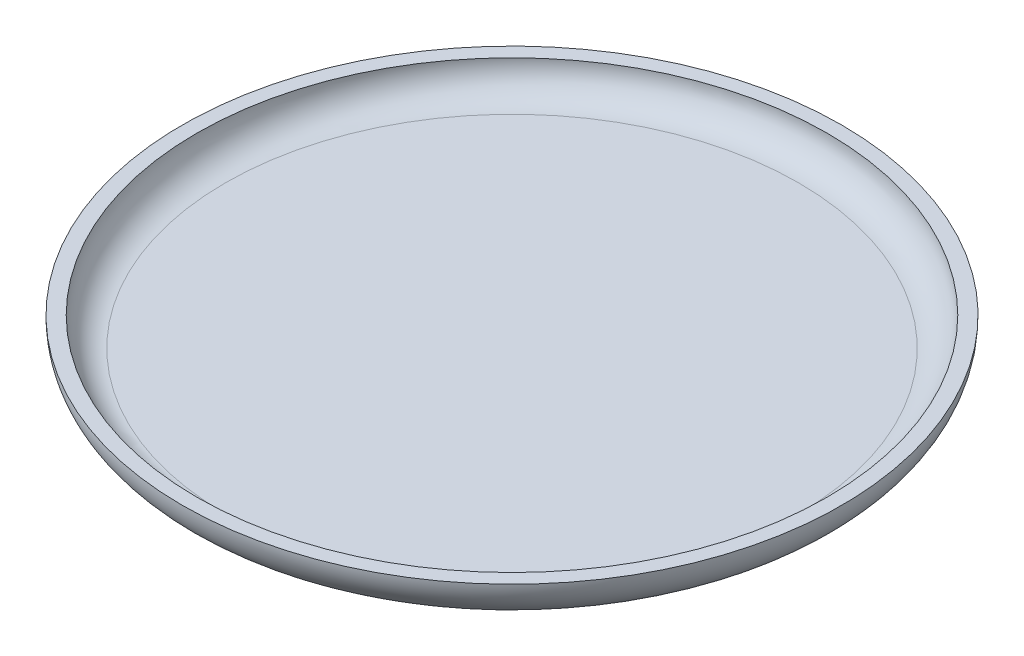
from build123d import *

# Parameters (mm, degrees)
SKETCH1_W          = 127
SKETCH1_H          = 6.35
SKETCH2_R          = 6.35
CUT_EXTRUDE1_DEPTH = 4.826


with BuildPart() as part:
    # Sketch1 → Revolve1 (revolve)
    with BuildSketch(Plane.XY, mode=Mode.PRIVATE) as revolve1_sk:
        with BuildLine():
            Line((127, 0), (127, 6.35))
            ThreePointArc((127, 6.35), (135.980256121, 10.069743879), (139.7, 19.05))
            Line((139.7, 19.05), (146.05, 19.05))
            ThreePointArc((146.05, 19.05), (140.470384182, 5.579615818), (127, 0))
        make_face()
        with Locations((63.5, 3.175)):
            Rectangle(SKETCH1_W, SKETCH1_H)
    revolve(revolve1_sk.sketch.rotate(Axis((0, 0, 0), (0, 1, 0)), 90), axis=Axis((0, 0, 0), (0, 1, 0)))

    # Sketch2 → Cut-Extrude1 (cut)
    with BuildSketch(Plane.XZ):
        with Locations(Location((0, 0, 0), (0, 0, 270))):
            Circle(SKETCH2_R)
    extrude(amount=-CUT_EXTRUDE1_DEPTH, mode=Mode.SUBTRACT)


solid = part.part
